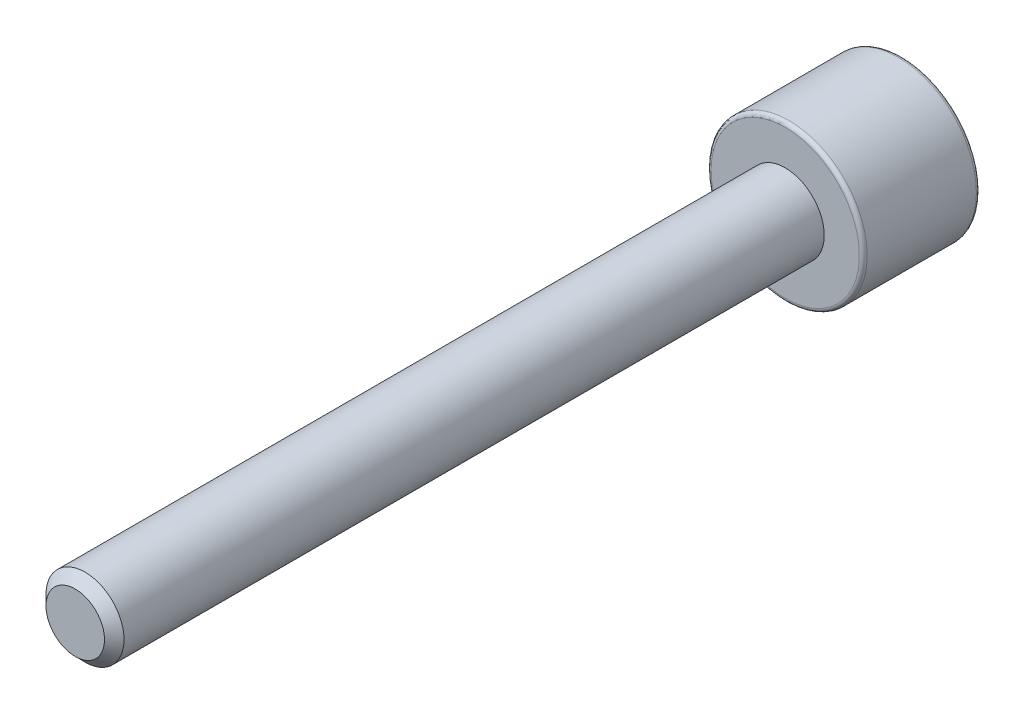
from build123d import *

# Parameters (mm, degrees)
CHAMFER1_SIZE           = 0.5
FILLET1_R               = 0.2
CUT_EXTRUDE1_DEPTH      = 43.775694052
CUT_EXTRUDE1_DEPTH_BACK = 5
FILLET2_R               = 0.2


with BuildPart() as part:
    # Sketch1 → Revolve1 (revolve)
    with BuildSketch(Plane.YZ, mode=Mode.PRIVATE) as revolve1_sk:
        Polygon((0, 36.4), (2, 36.4), (2, 0), (4, 0), (4, -6), (0, -6), align=None)
    revolve(revolve1_sk.sketch.rotate(Axis((0, 0, 38.548402149), (0, 0, -1)), 90), axis=Axis((0, 0, 38.548402149), (0, 0, -1)))

    # Chamfer1
    chamfer1_edges = [part.edges().sort_by_distance(p)[0] for p in [
        (-2, 0, 36.4),
    ]]
    chamfer(chamfer1_edges, length=CHAMFER1_SIZE)

    # Fillet1
    fillet1_edges = [part.edges().sort_by_distance(p)[0] for p in [
        (-4, 0, -6),
        (-4, 0, 0),
    ]]
    fillet(fillet1_edges, radius=FILLET1_R)

    # Sketch2 → Cut-Extrude1 (cut, two sides: drawn at the far end of the back side and taken through both)
    with BuildSketch(Plane(origin=(0, 0, -6), x_dir=(1, 0, 0), z_dir=(0, 0, -1)).offset(-CUT_EXTRUDE1_DEPTH_BACK)):
        Polygon((0, -3), (2.598076211, -1.5), (2.598076211, 1.5), (0, 3), (-2.598076211, 1.5), (-2.598076211, -1.5), align=None)
    extrude(amount=CUT_EXTRUDE1_DEPTH + CUT_EXTRUDE1_DEPTH_BACK, mode=Mode.SUBTRACT)

    # Fillet2
    fillet2_edges = [part.edges().sort_by_distance(p)[0] for p in [
        (-2.598076211, 1.5, -3.5),
        (-1.299038106, 2.25, -1),
        (0, 3, -3.5),
        (1.299038106, 2.25, -1),
        (2.598076211, 1.5, -3.5),
        (2.598076211, 0, -1),
        (2.598076211, -1.5, -3.5),
        (1.299038106, -2.25, -1),
        (0, -3, -3.5),
        (-1.299038106, -2.25, -1),
        (-2.598076211, -1.5, -3.5),
        (-2.598076211, 0, -1),
        (-1.299038106, 2.25, -6),
        (1.299038106, 2.25, -6),
        (2.598076211, 0, -6),
        (1.299038106, -2.25, -6),
        (-1.299038106, -2.25, -6),
        (-2.598076211, 0, -6),
    ]]
    fillet(fillet2_edges, radius=FILLET2_R)


solid = part.part
